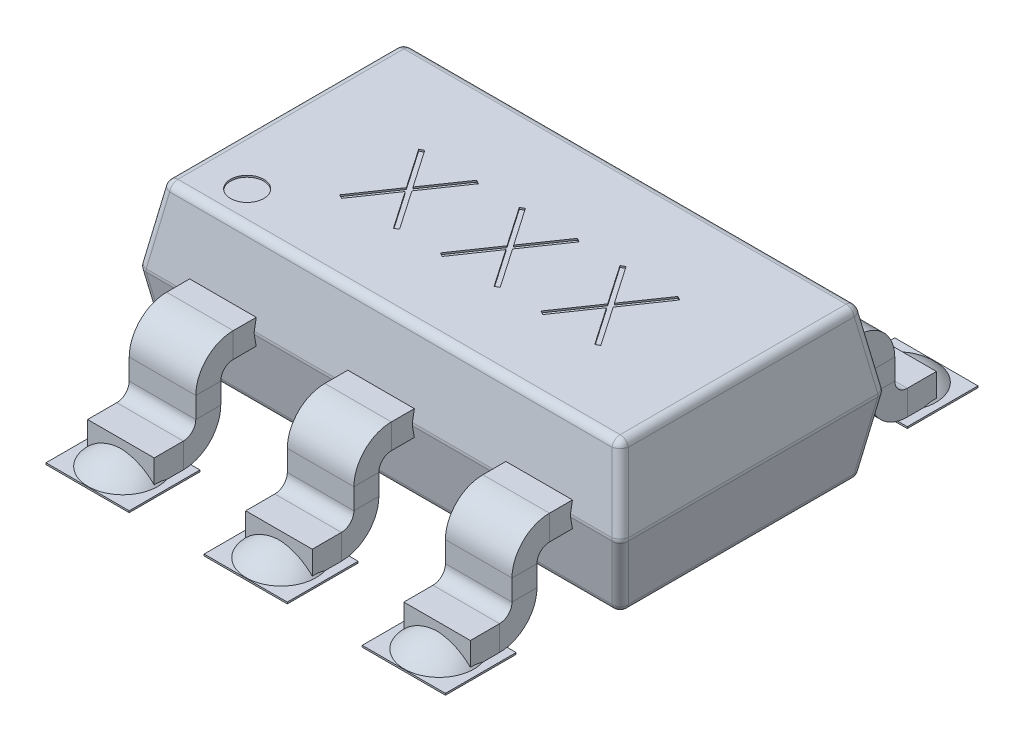
from build123d import *

# Parameters (mm, degrees)
CROQUIS1_W                        = 2.9
CROQUIS1_H                        = 1.6
SALIENTE_EXTRUIR1_DEPTH           = 0.45
SALIENTE_EXTRUIR1_TAPER           = 10
SALIENTE_EXTRUIR1_OTHER_WAY_DEPTH = 0.45
SALIENTE_EXTRUIR1_OTHER_WAY_TAPER = 10
CROQUIS2_R                        = 0.1
CORTAR_EXTRUIR1_DEPTH             = 0.01
REDONDEO1_R                       = 0.05
CROQUIS3_W                        = 0.4
CROQUIS3_H                        = 0.15
CROQUIS5_W                        = 0.5
CROQUIS5_H                        = 0.425
SALIENTE_EXTRUIR2_DEPTH           = 0.01
MATRIZL1_COUNT                    = 2
MATRIZL1_PITCH                    = 0.95
MATRIZL1_2_COUNT                  = 2
MATRIZL1_2_PITCH                  = 0.95


with BuildPart() as part:
    # Croquis1 → Saliente-Extruir1 (new body)
    with BuildSketch(Plane(origin=(0, 0, 0), x_dir=(1, 0, 0), z_dir=(0, 1, 0))):
        Rectangle(CROQUIS1_W, CROQUIS1_H)
    extrude(amount=SALIENTE_EXTRUIR1_DEPTH, taper=SALIENTE_EXTRUIR1_TAPER)

    # Croquis1 → Saliente-Extruir1 other way (add)
    with BuildSketch(Plane(origin=(0, 0, 0), x_dir=(1, 0, 0), z_dir=(0, 1, 0))):
        Rectangle(CROQUIS1_W, CROQUIS1_H)
    extrude(amount=-SALIENTE_EXTRUIR1_OTHER_WAY_DEPTH, taper=SALIENTE_EXTRUIR1_OTHER_WAY_TAPER)

    # Croquis2 → Cortar-Extruir1 (cut)
    with BuildSketch(Plane(origin=(0, 0.45, 0), x_dir=(1, 0, 0), z_dir=(0, 1, 0))):
        with Locations(Location((-1.070652859, -0.520652859, 0), (0, 0, 270))):
            Circle(CROQUIS2_R)
        Polygon((-0.761865061, 0.20112029), (-0.737714266, 0.213392036), (-0.58230488, -0.012211734), (-0.426208277, 0.213784732), (-0.402744699, 0.200825768), (-0.565418958, -0.036068007), (-0.402744699, -0.272961783), (-0.426208277, -0.286215268), (-0.58230488, -0.059629759), (-0.737714266, -0.286215268), (-0.761865061, -0.273354479), (-0.59889628, -0.036068007), align=None)
        Polygon((-0.15707741, 0.20112029), (-0.132926615, 0.213392036), (0.02248277, -0.012211734), (0.178579373, 0.213784732), (0.202042951, 0.200825768), (0.039368692, -0.036068007), (0.202042951, -0.272961783), (0.178579373, -0.286215268), (0.02248277, -0.059629759), (-0.132926615, -0.286215268), (-0.15707741, -0.273354479), (0.00589137, -0.036068007), align=None)
        Polygon((0.44771024, 0.20112029), (0.471861035, 0.213392036), (0.627270421, -0.012211734), (0.783367024, 0.213784732), (0.806830601, 0.200825768), (0.644156342, -0.036068007), (0.806830601, -0.272961783), (0.783367024, -0.286215268), (0.627270421, -0.059629759), (0.471861035, -0.286215268), (0.44771024, -0.273354479), (0.610679021, -0.036068007), align=None)
    extrude(amount=-CORTAR_EXTRUIR1_DEPTH, mode=Mode.SUBTRACT)

    # Redondeo1
    redondeo1_edges = [part.edges().sort_by_distance(p)[0] for p in [
        (-1.370652859, -0.45, 0),
        (0, -0.45, 0.720652859),
        (1.410326429, 0.225, 0.760326429),
        (1.410326429, 0.225, -0.760326429),
        (-1.410326429, 0.225, -0.760326429),
        (-1.410326429, 0.225, 0.760326429),
        (1.370652859, 0.45, 0),
        (0, 0.45, -0.720652859),
        (-1.370652859, 0.45, 0),
        (0, 0.45, 0.720652859),
        (1.370652859, -0.45, 0),
        (0, 0, 0.8),
        (-1.45, 0, 0),
        (0, 0, -0.8),
        (1.45, 0, 0),
        (0, -0.45, -0.720652859),
        (1.410326429, -0.225, 0.760326429),
        (-1.410326429, -0.225, 0.760326429),
        (-1.410326429, -0.225, -0.760326429),
        (1.410326429, -0.225, -0.760326429),
    ]]
    fillet(redondeo1_edges, radius=REDONDEO1_R)


with BuildPart() as body_2:
    # Barrer1: sweep along a path in Croquis4
    with BuildLine(Plane(origin=(0, 0, 0), x_dir=(0, 0, -1), z_dir=(1, 0, 0))) as barrer1_path:
        Line((-1.4, -0.425), (-1.225, -0.425))
        ThreePointArc((-1.225, -0.425), (-1.118933983, -0.381066017), (-1.075, -0.275))
        Line((-1.075, -0.275), (-1.075, -0.15))
        ThreePointArc((-1.075, -0.15), (-1.031066017, -0.043933983), (-0.925, 0))
        Line((-0.925, 0), (0, 0))
    # Croquis3 → Barrer1 (sweep)
    with BuildSketch(Plane.XY.offset(1.4)):
        with Locations((0, -0.425)):
            Rectangle(CROQUIS3_W, CROQUIS3_H)
    sweep(path=barrer1_path.line)

    # Croquis5 → Saliente-Extruir2 (add)
    with BuildSketch(Plane.XZ.offset(0.5)):
        with Locations((0, 1.3875)):
            Rectangle(CROQUIS5_W, CROQUIS5_H)
    extrude(amount=SALIENTE_EXTRUIR2_DEPTH)

    # Croquis6 → Revolución1 (revolve)
    with BuildSketch(Plane.XY.offset(1.3875)):
        with BuildLine():
            Line((0, -0.5), (0, -0.400719471))
            ThreePointArc((0, -0.400719471), (0.114738426, -0.429448528), (0.209673957, -0.5))
            Line((0.209673957, -0.5), (0, -0.5))
        make_face()
    revolve(axis=Axis((0, -0.5, 1.3875), (0, 1, 0)))


with BuildPart() as matrizl1_1:
    # MatrizL1: pattern copy
    add(body_2.part.moved(Location(Vector(1, 0, 0) * (1 * MATRIZL1_PITCH))))


with BuildPart() as matrizl1_2_1:
    # MatrizL1 2: pattern copy
    add(body_2.part.moved(Location(Vector(-1, 0, 0) * (1 * MATRIZL1_2_PITCH))))


with BuildPart() as body_5:
    # Simetría1: mirrored copy
    add(matrizl1_2_1.part.mirror(Plane.XY))


with BuildPart() as body_6:
    # Simetr_a1 2: mirrored copy
    add(matrizl1_1.part.mirror(Plane.XY))


solid = Compound([part.part, body_2.part, matrizl1_1.part, matrizl1_2_1.part, body_5.part, body_6.part])
